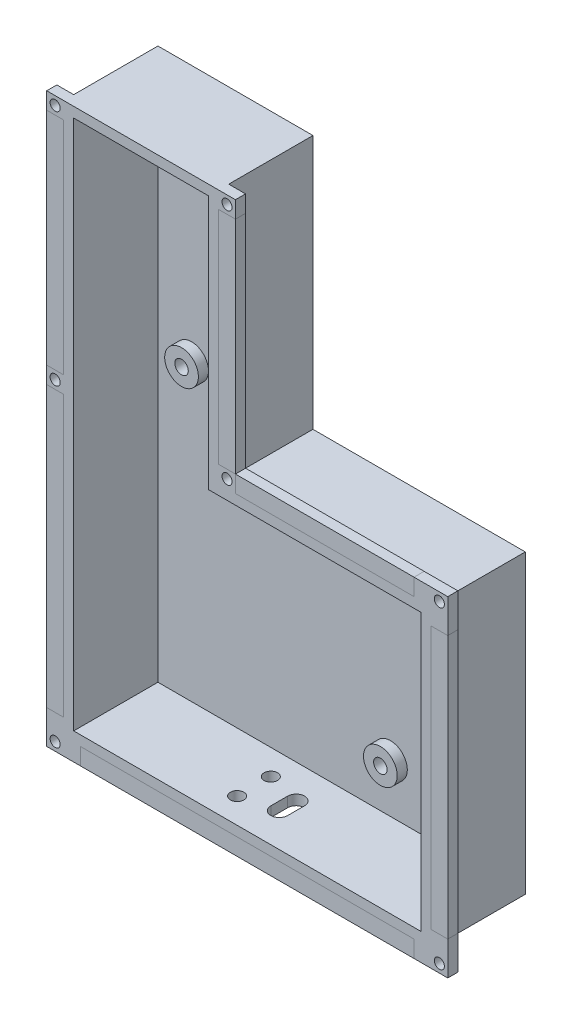
from build123d import *

# Parameters (mm, degrees)
SKICA1_W                   = 40
SKICA1_H                   = 152
P_IDAT_VYSUNUT_M1_DEPTH    = 3
SKICA2_W                   = 46
SKICA2_H                   = 163.5
P_IDAT_VYSUNUT_M2_DEPTH    = 3
SKICA3_W                   = 46
SKICA3_H                   = 163.5
SKICA3_W_2                 = 40
SKICA3_H_2                 = 157.5
P_IDAT_VYSUNUT_M3_DEPTH    = 25
SKICA6_W                   = 60
SKICA6_H                   = 85
P_IDAT_VYSUNUT_M6_DEPTH    = 3
P_IDAT_VYSUNUT_M8_DEPTH    = 28
SKICA8_W                   = 3
SKICA8_H                   = 82
ODEBRAT_VYSUNUT_M2_DEPTH   = 25
SKICA4_R                   = 5
SKICA4_R_2                 = 2
P_IDAT_VYSUNUT_M4_DEPTH    = 3
SKICA10_R                  = 5
SKICA10_R_2                = 2
P_IDAT_VYSUNUT_M11_DEPTH   = 3
ODEBRAT_START              = -1
SKICA5_R                   = 2
ODEBRAT_VYSUNUT_M1_DEPTH   = 1
SKICA11_R                  = 2
ODEBRAT_VYSUNUT_M3_DEPTH   = 1
SKICA12_R                  = 2
ODEBRAT_VYSUNUT_M4_DEPTH   = 3
SKICA16_W                  = 5
SKICA16_H                  = 5
SKICA16_R                  = 1.5
P_IDAT_VYSUNUT_M13_DEPTH   = 3
SKICA17_W                  = 5
SKICA17_H                  = 65.5
P_IDAT_VYSUNUT_M19_DEPTH   = 3
SKICA17_W_2                = 53
SKICA17_H_2                = 5
P_IDAT_VYSUNUT_M19_2_DEPTH = 3
SKICA17_H_3                = 78
P_IDAT_VYSUNUT_M19_3_DEPTH = 3
P_IDAT_VYSUNUT_M19_4_DEPTH = 3
SKICA17_H_4                = 83
P_IDAT_VYSUNUT_M19_5_DEPTH = 3
SKICA17_W_3                = 99
P_IDAT_VYSUNUT_M19_6_DEPTH = 3


with BuildPart() as part:
    # Skica1 → Přidat vysunutím1 (new body)
    with BuildSketch(Plane.XY):
        with Locations((-129.882430403, 98.650557891)):
            Rectangle(SKICA1_W, SKICA1_H)
        Polygon((-149.882430403, 180.150557891), (-145.782430403, 180.150557891), (-113.782430403, 180.150557891), (-109.882430403, 180.150557891), (-109.882430403, 174.650557891), (-149.882430403, 174.650557891), align=None)
    extrude(amount=-P_IDAT_VYSUNUT_M1_DEPTH)



with BuildPart() as body_2:
    # Skica2 → Přidat vysunutím2 (new body)
    with BuildSketch(Plane.XY):
        with Locations((-129.882430403, 101.400557891)):
            Rectangle(SKICA2_W, SKICA2_H)
    extrude(amount=-P_IDAT_VYSUNUT_M2_DEPTH)


with BuildPart() as part_1:
    add(part.part)

    add(body_2.part)  # Přidat vysunutím3 merges body 2
    # Skica3 → Přidat vysunutím3 (add)
    with BuildSketch(Plane.XY):
        with Locations((-129.882430403, 101.400557891)):
            Rectangle(SKICA3_W, SKICA3_H)
        with Locations((-129.882430403, 101.400557891)):
            Rectangle(SKICA3_W_2, SKICA3_H_2, mode=Mode.SUBTRACT)
    extrude(amount=P_IDAT_VYSUNUT_M3_DEPTH)

    # Skica6 → Přidat vysunutím6 (add)
    with BuildSketch(Plane(origin=(0, 0, -3), x_dir=(-1, 0, 0), z_dir=(0, 0, -1))):
        with Locations((76.882430403, 62.150557891)):
            Rectangle(SKICA6_W, SKICA6_H)
    extrude(amount=-P_IDAT_VYSUNUT_M6_DEPTH)

    # Skica7 → Přidat vysunutím8 (add)
    with BuildSketch(Plane(origin=(0, 0, -3), x_dir=(-1, 0, 0), z_dir=(0, 0, -1))):
        Polygon((106.882430403, 104.650557891), (106.882430403, 107.650557891), (43.882430403, 107.650557891), (43.882430403, 19.650557891), (46.882430403, 19.650557891), (46.882430403, 22.650557891), (46.882430403, 104.650557891), align=None)
        Polygon((106.882430403, 19.650557891), (109.882430403, 22.650557891), (46.882430403, 22.650557891), (46.882430403, 19.650557891), align=None)
    extrude(amount=-P_IDAT_VYSUNUT_M8_DEPTH)

    # Skica8 → Odebrat vysunutím2 (cut)
    with BuildSketch(Plane.XY.offset(25)):
        with Locations((-108.382430403, 63.650557891)):
            Rectangle(SKICA8_W, SKICA8_H)
    extrude(amount=-ODEBRAT_VYSUNUT_M2_DEPTH, mode=Mode.SUBTRACT)

    # Skica4 → Přidat vysunutím4 (add)
    # profile 1 of 2: a face of its own
    with BuildSketch(Plane.XY):
        with Locations((-119.882430403, 110.150557891)):
            Circle(SKICA4_R)
        with Locations((-119.882430403, 110.150557891)):
            Circle(SKICA4_R_2, mode=Mode.SUBTRACT)
    # profile 2 of 2: a face of its own
    with BuildSketch(Plane.XY):
        with Locations((-139.882430403, 110.150557891)):
            Circle(SKICA4_R)
        with Locations((-139.882430403, 110.150557891)):
            Circle(SKICA4_R_2, mode=Mode.SUBTRACT)
    extrude(amount=P_IDAT_VYSUNUT_M4_DEPTH)

    # Skica10 → Přidat vysunutím11 (add)
    # profile 1 of 4: a face of its own
    with BuildSketch(Plane.XY):
        with Locations((-80.882430403, 90.150557891)):
            Circle(SKICA10_R)
        with Locations((-80.882430403, 90.150557891)):
            Circle(SKICA10_R_2, mode=Mode.SUBTRACT)
    # profile 2 of 4: a face of its own
    with BuildSketch(Plane.XY):
        with Locations((-58.882430403, 90.150557891)):
            Circle(SKICA10_R)
        with Locations((-58.882430403, 90.150557891)):
            Circle(SKICA10_R_2, mode=Mode.SUBTRACT)
    # profile 3 of 4: a face of its own
    with BuildSketch(Plane.XY):
        with Locations((-58.882430403, 37.150557891)):
            Circle(SKICA10_R)
        with Locations((-58.882430403, 37.150557891)):
            Circle(SKICA10_R_2, mode=Mode.SUBTRACT)
    # profile 4 of 4: a face of its own
    with BuildSketch(Plane.XY):
        with Locations((-80.882430403, 37.150557891)):
            Circle(SKICA10_R)
        with Locations((-80.882430403, 37.150557891)):
            Circle(SKICA10_R_2, mode=Mode.SUBTRACT)
    extrude(amount=P_IDAT_VYSUNUT_M11_DEPTH)

    # Skica5 → Odebrat vysunutím1 (cut)
    with BuildSketch(Plane.XY.offset(ODEBRAT_START)):
        with Locations((-139.882430403, 110.150557891)):
            Circle(SKICA5_R)
        with Locations((-119.882430403, 110.150557891)):
            Circle(SKICA5_R)
    extrude(amount=ODEBRAT_VYSUNUT_M1_DEPTH, mode=Mode.SUBTRACT)

    # Skica11 → Odebrat vysunutím3 (cut)
    with BuildSketch(Plane.XY.offset(ODEBRAT_START)):
        with Locations((-80.882430403, 90.150557891)):
            Circle(SKICA11_R)
        with Locations((-58.882430403, 90.150557891)):
            Circle(SKICA11_R)
        with Locations((-80.882430403, 37.150557891)):
            Circle(SKICA11_R)
        with Locations((-58.882430403, 37.150557891)):
            Circle(SKICA11_R)
    extrude(amount=ODEBRAT_VYSUNUT_M3_DEPTH, mode=Mode.SUBTRACT)

    # Skica12 → Odebrat vysunutím4 (cut)
    with BuildSketch(Plane(origin=(0, 22.650557891, 0), x_dir=(1, 0, 0), z_dir=(0, 1, 0))):
        with Locations(Location((-108.882430403, -17.5, 0), (0, 0, 270))):
            Circle(SKICA12_R)
        with Locations(Location((-108.882430403, -7.5, 0), (0, 0, 270))):
            Circle(SKICA12_R)
        with BuildLine():
            Line((-96.382430403, -10), (-96.382430403, -15))
            ThreePointArc((-96.382430403, -15), (-98.882430403, -17.5), (-101.382430403, -15))
            Line((-101.382430403, -15), (-101.382430403, -10))
            ThreePointArc((-101.382430403, -10), (-98.882430403, -7.5), (-96.382430403, -10))
        make_face()
    extrude(amount=-ODEBRAT_VYSUNUT_M4_DEPTH, mode=Mode.SUBTRACT)

    # Skica16 → Přidat vysunutím13 (add)
    # profile 1 of 7: a face of its own
    with BuildSketch(Plane(origin=(0, 0, 25), x_dir=(-1, 0, 0), z_dir=(0, 0, -1))):
        with Locations((104.382430403, 110.150557891)):
            Rectangle(SKICA16_W, SKICA16_H)
        with Locations((104.382430403, 110.150557891)):
            Circle(SKICA16_R, mode=Mode.SUBTRACT)
    # profile 2 of 7: a face of its own
    with BuildSketch(Plane(origin=(0, 0, 25), x_dir=(-1, 0, 0), z_dir=(0, 0, -1))):
        Polygon((43.882430403, 112.650557891), (38.882430403, 112.650557891), (38.882430403, 107.650557891), (38.882430403, 102.650557891), (43.882430403, 102.650557891), (43.882430403, 107.650557891), (48.882430403, 107.650557891), (48.882430403, 112.650557891), align=None)
        with Locations((41.382430403, 110.150557891)):
            Circle(SKICA16_R, mode=Mode.SUBTRACT)
    # profile 3 of 7: a face of its own
    with BuildSketch(Plane(origin=(0, 0, 25), x_dir=(-1, 0, 0), z_dir=(0, 0, -1))):
        Polygon((38.882430403, 14.650557891), (43.882430403, 14.650557891), (48.882430403, 14.650557891), (48.882430403, 19.650557891), (43.882430403, 19.650557891), (43.882430403, 24.650557891), (38.882430403, 24.650557891), (38.882430403, 19.650557891), align=None)
        with Locations((41.382430403, 17.150557891)):
            Circle(SKICA16_R, mode=Mode.SUBTRACT)
    # profile 4 of 7: a face of its own
    with BuildSketch(Plane(origin=(0, 0, 25), x_dir=(-1, 0, 0), z_dir=(0, 0, -1))):
        Polygon((157.882430403, 14.650557891), (152.882430403, 14.650557891), (147.882430403, 14.650557891), (147.882430403, 19.650557891), (152.882430403, 19.650557891), (152.882430403, 24.650557891), (157.882430403, 24.650557891), (157.882430403, 19.650557891), align=None)
        with Locations((155.382430403, 17.150557891)):
            Circle(SKICA16_R, mode=Mode.SUBTRACT)
    # profile 5 of 7: a face of its own
    with BuildSketch(Plane(origin=(0, 0, 25), x_dir=(-1, 0, 0), z_dir=(0, 0, -1))):
        with Locations((104.382430403, 180.650557891)):
            Rectangle(SKICA16_W, SKICA16_H)
        with Locations((104.382430403, 180.650557891)):
            Circle(SKICA16_R, mode=Mode.SUBTRACT)
    # profile 6 of 7: a face of its own
    with BuildSketch(Plane(origin=(0, 0, 25), x_dir=(-1, 0, 0), z_dir=(0, 0, -1))):
        with Locations((155.382430403, 180.650557891)):
            Rectangle(SKICA16_W, SKICA16_H)
        with Locations((155.382430403, 180.650557891)):
            Circle(SKICA16_R, mode=Mode.SUBTRACT)
    # profile 7 of 7: a face of its own
    with BuildSketch(Plane(origin=(0, 0, 25), x_dir=(-1, 0, 0), z_dir=(0, 0, -1))):
        with Locations((155.382430403, 110.150557891)):
            Rectangle(SKICA16_W, SKICA16_H)
        with Locations((155.382430403, 110.150557891)):
            Circle(SKICA16_R, mode=Mode.SUBTRACT)
    extrude(amount=P_IDAT_VYSUNUT_M13_DEPTH)


with BuildPart() as body_2_2:
    # Skica17 → Přidat vysunutím19 (new body)
    with BuildSketch(Plane(origin=(0, 0, 22), x_dir=(-1, 0, 0), z_dir=(0, 0, -1))):
        with Locations((104.382430403, 145.400557891)):
            Rectangle(SKICA17_W, SKICA17_H)
    extrude(amount=-P_IDAT_VYSUNUT_M19_DEPTH)


with BuildPart() as body_3:
    # Skica17 → P_idat vysunut_m19 2 (new body)
    with BuildSketch(Plane(origin=(0, 0, 22), x_dir=(-1, 0, 0), z_dir=(0, 0, -1))):
        with Locations((75.382430403, 110.150557891)):
            Rectangle(SKICA17_W_2, SKICA17_H_2)
    extrude(amount=-P_IDAT_VYSUNUT_M19_2_DEPTH)


with BuildPart() as body_4:
    # Skica17 → P_idat vysunut_m19 3 (new body)
    with BuildSketch(Plane(origin=(0, 0, 22), x_dir=(-1, 0, 0), z_dir=(0, 0, -1))):
        with Locations((41.382430403, 63.650557891)):
            Rectangle(SKICA17_W, SKICA17_H_3)
    extrude(amount=-P_IDAT_VYSUNUT_M19_3_DEPTH)


with BuildPart() as body_5:
    # Skica17 → P_idat vysunut_m19 4 (new body)
    with BuildSketch(Plane(origin=(0, 0, 22), x_dir=(-1, 0, 0), z_dir=(0, 0, -1))):
        with Locations((155.382430403, 145.400557891)):
            Rectangle(SKICA17_W, SKICA17_H)
    extrude(amount=-P_IDAT_VYSUNUT_M19_4_DEPTH)


with BuildPart() as body_6:
    # Skica17 → P_idat vysunut_m19 5 (new body)
    with BuildSketch(Plane(origin=(0, 0, 22), x_dir=(-1, 0, 0), z_dir=(0, 0, -1))):
        with Locations((155.382430403, 66.150557891)):
            Rectangle(SKICA17_W, SKICA17_H_4)
    extrude(amount=-P_IDAT_VYSUNUT_M19_5_DEPTH)


with BuildPart() as body_7:
    # Skica17 → P_idat vysunut_m19 6 (new body)
    with BuildSketch(Plane(origin=(0, 0, 22), x_dir=(-1, 0, 0), z_dir=(0, 0, -1))):
        with Locations((98.382430403, 17.150557891)):
            Rectangle(SKICA17_W_3, SKICA17_H_2)
    extrude(amount=-P_IDAT_VYSUNUT_M19_6_DEPTH)


solid = Compound([part_1.part, body_2_2.part, body_3.part, body_4.part, body_5.part, body_6.part, body_7.part])
